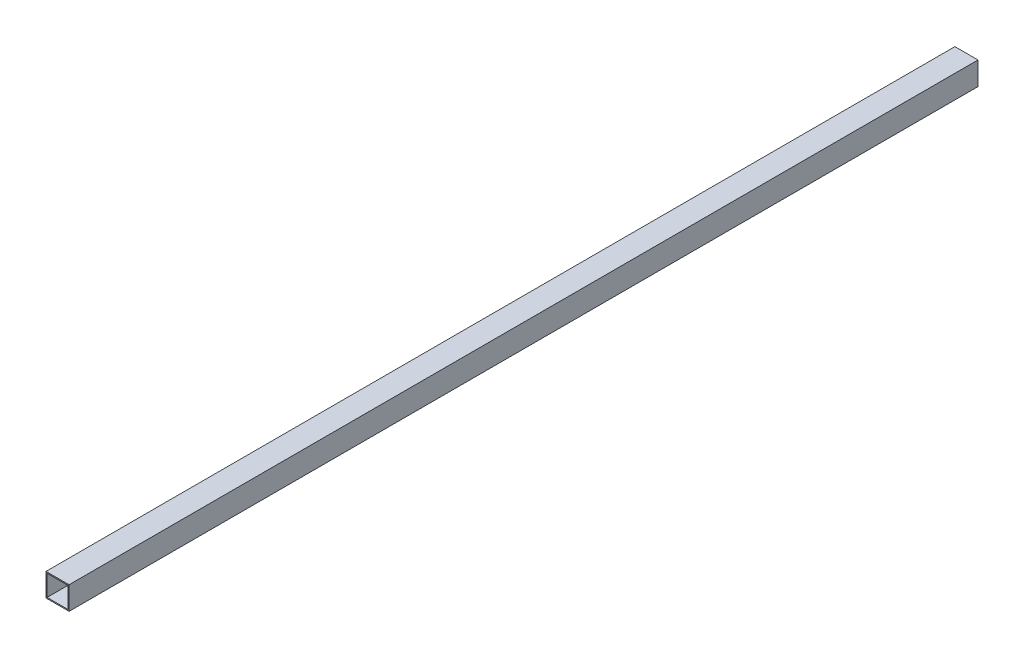
from build123d import *

# Parameters (mm, degrees)
SKETCH1_W           = 25.4
SKETCH1_H           = 25.4
SKETCH1_W_2         = 23
SKETCH1_H_2         = 23
BOSS_EXTRUDE1_DEPTH = 500


with BuildPart() as part:
    # Sketch1 → Boss-Extrude1 (new, symmetric)
    with BuildSketch(Plane.XY):
        Rectangle(SKETCH1_W, SKETCH1_H)
        Rectangle(SKETCH1_W_2, SKETCH1_H_2, mode=Mode.SUBTRACT)
    extrude(amount=BOSS_EXTRUDE1_DEPTH, both=True)


solid = part.part
